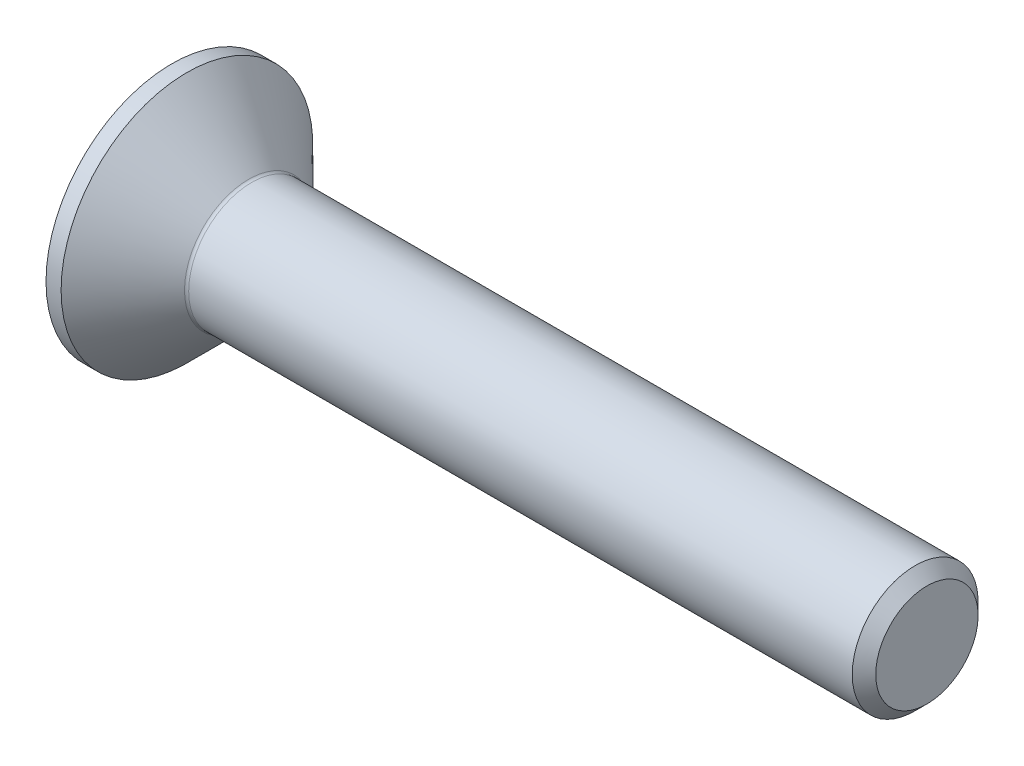
from build123d import *

# Parameters (mm, degrees)
FILLET1_R   = 0.1
HEX_2_DEPTH = 1.1


with BuildPart() as part:
    # BodySke → BaseBody (revolve)
    with BuildSketch(Plane.XY, mode=Mode.PRIVATE) as basebody_sk:
        Polygon((0, 0), (0, 3), (0.36, 3), (1.86, 1.5), (17.7195, 1.5), (18, 1.2195), (18, 0), align=None)
    revolve(basebody_sk.sketch.rotate(Axis((0, 0, 0), (1, 0, 0)), 90), axis=Axis((0, 0, 0), (1, 0, 0)))

    # Fillet1
    fillet1_edges = [part.edges().sort_by_distance(p)[0] for p in [
        (1.86, 0, -1.5),
    ]]
    fillet(fillet1_edges, radius=FILLET1_R)

    # Sketch2 → PreBroach (revolve, cut)
    with BuildSketch(Plane.XY, mode=Mode.PRIVATE) as prebroach_sk:
        Polygon((0, 1), (1.1, 1), (1.677350269, 0), (0, 0), align=None)
    revolve(prebroach_sk.sketch.rotate(Axis((0, 0, 0), (1, 0, 0)), 90), axis=Axis((0, 0, 0), (1, 0, 0)), mode=Mode.SUBTRACT)

    # Sketch3 → Hex 2 (cut)
    with BuildSketch(Plane.ZY):
        Polygon((-1, -0.577350269), (-1, 0.577350269), (0, 1.154700538), (1, 0.577350269), (1, -0.577350269), (0, -1.154700538), align=None)
    extrude(amount=-HEX_2_DEPTH, mode=Mode.SUBTRACT)


solid = part.part
